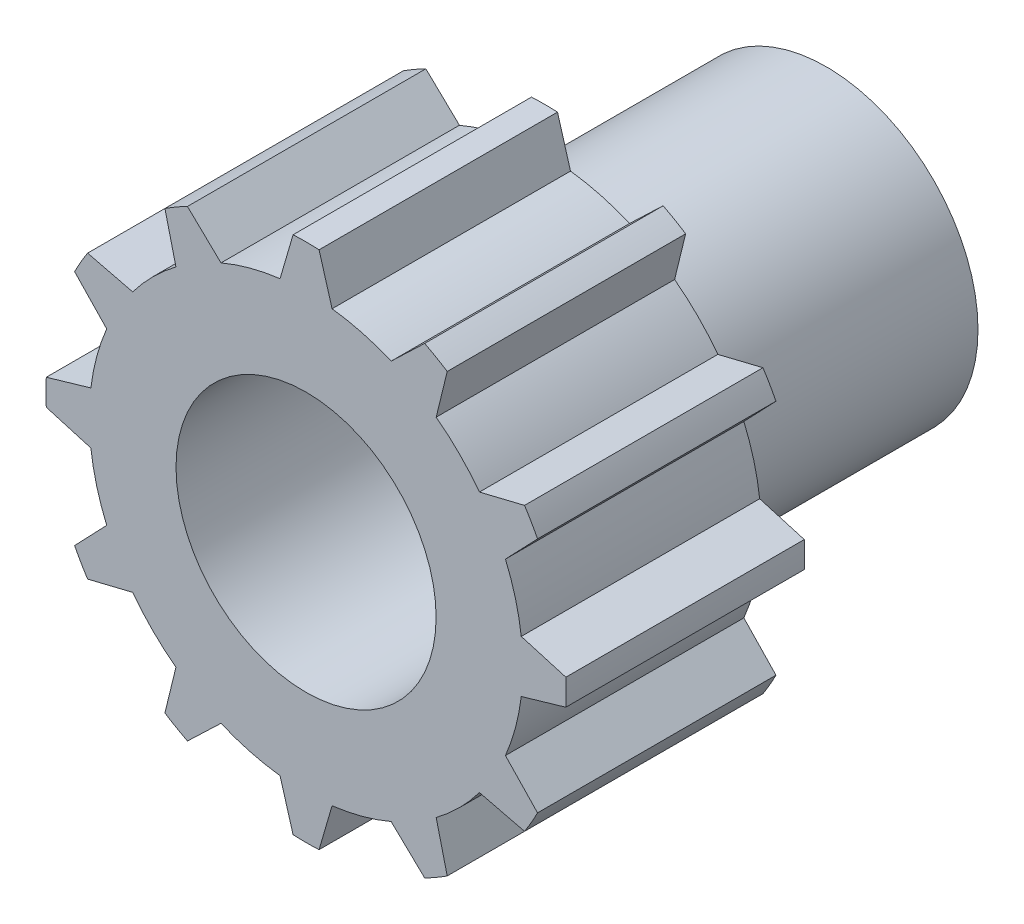
from build123d import *

# Parameters (mm, degrees)
SKETCH1_R           = 5
SKETCH1_R_2         = 3
BOSS_EXTRUDE1_DEPTH = 5.5
BOSS_EXTRUDE2_START = -5.5
BOSS_EXTRUDE2_DEPTH = 5.5
CIRPATTERN1_COUNT   = 12
BOSS_EXTRUDE3_START = -6.5
SKETCH4_R           = 3.5
SKETCH4_R_2         = 3
BOSS_EXTRUDE3_DEPTH = 6.5
SKETCH5_R           = 1.75
CUT_EXTRUDE1_DEPTH  = 6.5


with BuildPart() as part:
    # Sketch1 → Boss-Extrude1 (new body)
    with BuildSketch(Plane.XY):
        Circle(SKETCH1_R)
        Circle(SKETCH1_R_2, mode=Mode.SUBTRACT)
    extrude(amount=BOSS_EXTRUDE1_DEPTH)

    # Sketch3 → Boss-Extrude2 (add)
    with BuildSketch(Plane.XY.offset(5.5).offset(BOSS_EXTRUDE2_START)):
        with BuildLine():
            Line((-0.3, -5.992495307), (-0.6, -4.963869458))
            ThreePointArc((-0.6, -4.963869458), (0, -5), (0.6, -4.963869458))
            Line((0.6, -4.963869458), (0.3, -5.992495307))
            ThreePointArc((0.3, -5.992495307), (0, -6), (-0.3, -5.992495307))
        make_face()
    boss_extrude2 = extrude(amount=BOSS_EXTRUDE2_DEPTH)

    # CirPattern1: Boss-Extrude2 ×12 about axis
    cirpattern1_axis = Axis((0, 0, 0), (0, 0, 1))
    for i in range(1, CIRPATTERN1_COUNT):
        add(boss_extrude2.rotate(cirpattern1_axis, i * 360 / CIRPATTERN1_COUNT))

    # Sketch4 → Boss-Extrude3 (add)
    with BuildSketch(Plane.XY.offset(BOSS_EXTRUDE3_START)):
        Circle(SKETCH4_R)
        Circle(SKETCH4_R_2, mode=Mode.SUBTRACT)
    extrude(amount=BOSS_EXTRUDE3_DEPTH)

    # Sketch5 → Cut-Extrude1 (cut)
    with BuildSketch(Plane(origin=(0, 0, 0), x_dir=(1, 0, 0), z_dir=(0, 1, 0))):
        with Locations(Location((0, 3.25, 0), (0, 0, 270))):
            Circle(SKETCH5_R)
    extrude(amount=-CUT_EXTRUDE1_DEPTH, mode=Mode.SUBTRACT)


solid = part.part
